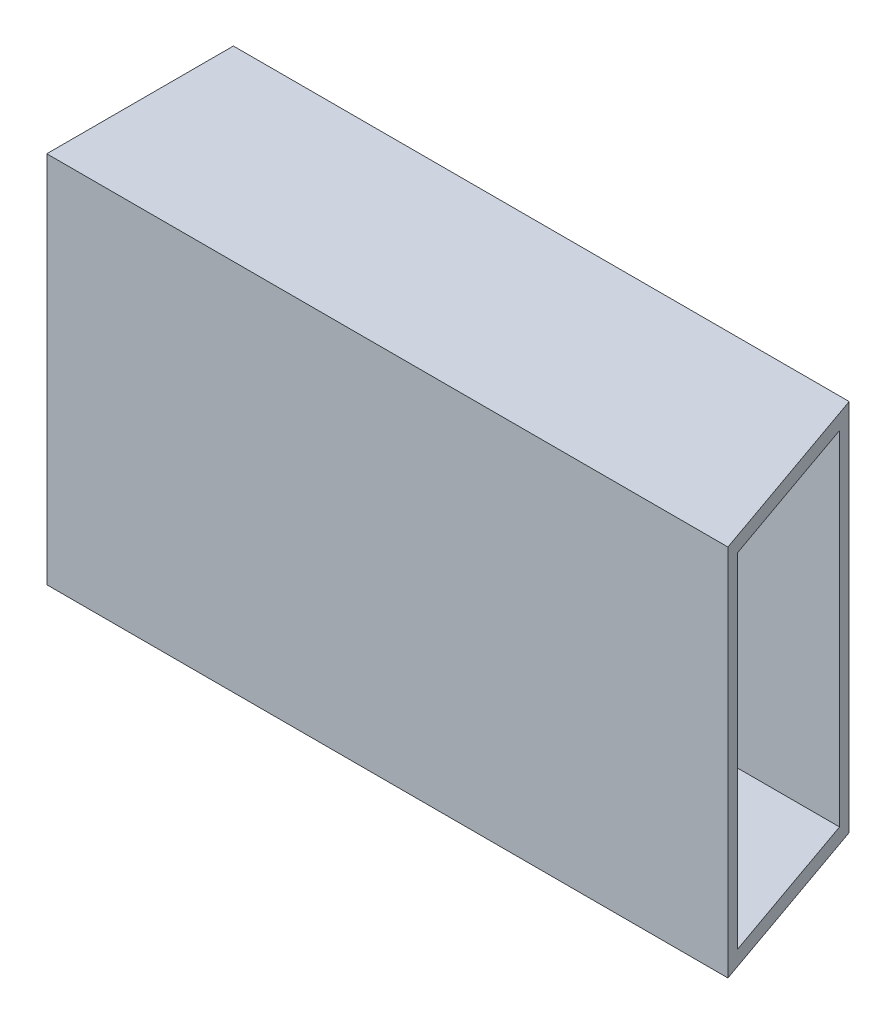
from build123d import *

# Parameters (mm, degrees)
DODANIE_WYCI_GNI_CIE1_DEPTH = 100
SZKIC2_W                    = 42
SZKIC2_H                    = 92
WYTNIJ_WYCI_GNI_CIE1_DEPTH  = 200


with BuildPart() as part:
    # Szkic1 → Dodanie-wyciągnięcie1 (new body)
    with BuildSketch(Plane(origin=(0, 0, 0), x_dir=(1, 0, 0), z_dir=(0, 1, 0))):
        Polygon((0, 0), (182.5, 0), (165, 50), (0, 50), align=None)
    extrude(amount=DODANIE_WYCI_GNI_CIE1_DEPTH)

    # Szkic2 → Wytnij-wyciągnięcie1 (cut)
    with BuildSketch(Plane.ZY):
        with Locations((-25, 50)):
            Rectangle(SZKIC2_W, SZKIC2_H)
    extrude(amount=-WYTNIJ_WYCI_GNI_CIE1_DEPTH, mode=Mode.SUBTRACT)


solid = part.part
